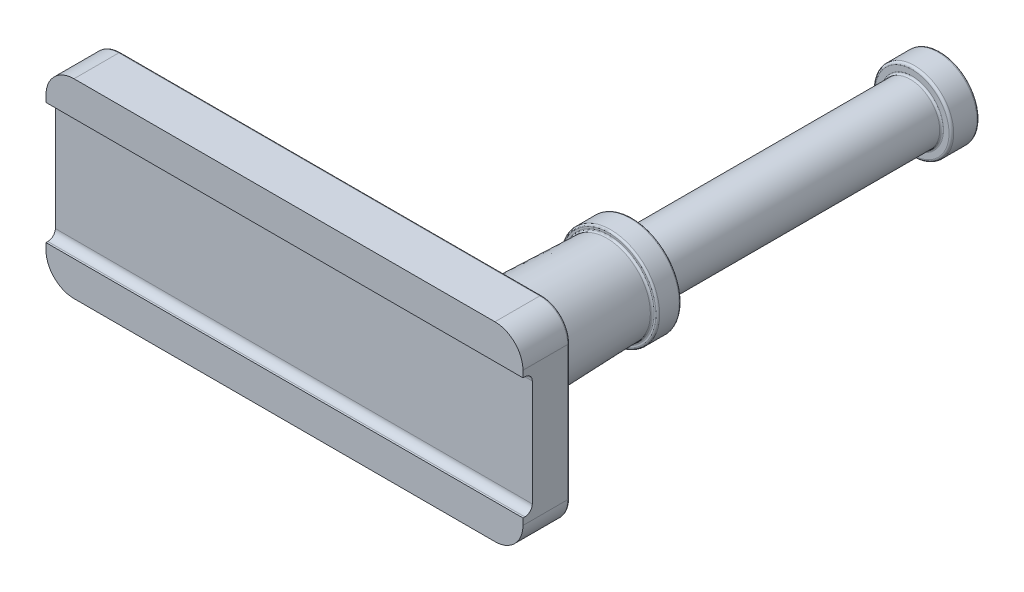
from build123d import *

# Parameters (mm, degrees)
SKETCH1_W      = 2555
SKETCH1_H      = 1020
EXTRUDE1_DEPTH = 250
FILLET1_R      = 150
FILLET2_R      = 10
EXTRUDE2_DEPTH = 150
FILLET3_R      = 20
EXTRUDE3_DEPTH = 50
FILLET4_R      = 10
EXTRUDE4_DEPTH = 3611.834391107
SCALE1_SCALE   = 0.8
FILLET5_R      = 10


with BuildPart() as part:
    # Sketch1 → Extrude1 (new body)
    with BuildSketch(Plane.XY):
        Rectangle(SKETCH1_W, SKETCH1_H)
    extrude(amount=EXTRUDE1_DEPTH)

    # Fillet1
    fillet1_edges = [part.edges().sort_by_distance(p)[0] for p in [
        (1277.5, -510, 125),
        (-1277.5, -510, 125),
        (-1277.5, 510, 125),
        (1277.5, 510, 125),
    ]]
    fillet(fillet1_edges, radius=FILLET1_R)

    # Sketch4 → Revolve1 (revolve)
    with BuildSketch(Plane(origin=(762.5, 0, 0), x_dir=(0, 0, -1), z_dir=(1, 0, 0)), mode=Mode.PRIVATE) as revolve1_sk:
        Polygon((0, 0), (2500, 0), (2500, 210), (2350, 210), (2350, 157.5), (850, 157.5), (850, 262.5), (725, 262.5), (725, 232.5), (80, 255.023896322), (80, 300), (0, 300), align=None)
    revolve(revolve1_sk.sketch.rotate(Axis((762.5, 0, -2500), (0, 0, -1)), 90), axis=Axis((762.5, 0, -2500), (0, 0, -1)))

    # Fillet2
    fillet2_edges = [part.edges().sort_by_distance(p)[0] for p in [
        (462.5, 0, 0),
        (605, 0, -2350),
        (605, 0, -850),
        (500, 0, -850),
        (500, 0, -725),
        (530, 0, -725),
        (507.476103678, 0, -80),
        (462.5, 0, -80),
    ]]
    fillet(fillet2_edges, radius=FILLET2_R)

    # Sketch5 → Extrude2 (cut)
    with BuildSketch(Plane(origin=(0, 0, 0), x_dir=(-1, 0, 0), z_dir=(0, 0, -1))):
        with BuildLine():
            Line((1127.5, 395), (1127.5, 315))
            Line((1127.5, 315), (1072.5, 260))
            Line((1072.5, 260), (-290, 260))
            Line((-290, 260), (-302.5, 272.5))
            Line((-302.5, 272.5), (-382.5, 272.5))
            Line((-382.5, 272.5), (-382.5, 222.5))
            Line((-382.5, 222.5), (-302.5, 222.5))
            Line((-302.5, 222.5), (-290, 235))
            Line((-290, 235), (1072.5, 235))
            Line((1072.5, 235), (1072.5, 95))
            Line((1072.5, 95), (-290, 95))
            Line((-290, 95), (-302.5, 107.5))
            Line((-302.5, 107.5), (-382.5, 107.5))
            Line((-382.5, 107.5), (-382.5, 57.5))
            Line((-382.5, 57.5), (-302.5, 57.5))
            Line((-302.5, 57.5), (-290, 70))
            Line((-290, 70), (1072.5, 70))
            Line((1072.5, 70), (1072.5, -70))
            Line((1072.5, -70), (-290, -70))
            Line((-290, -70), (-302.5, -57.5))
            Line((-302.5, -57.5), (-382.5, -57.5))
            Line((-382.5, -57.5), (-382.5, -107.5))
            Line((-382.5, -107.5), (-302.5, -107.5))
            Line((-302.5, -107.5), (-290, -95))
            Line((-290, -95), (1072.5, -95))
            Line((1072.5, -95), (1072.5, -235))
            Line((1072.5, -235), (-290, -235))
            Line((-290, -235), (-302.5, -222.5))
            Line((-302.5, -222.5), (-382.5, -222.5))
            Line((-382.5, -222.5), (-382.5, -272.5))
            Line((-382.5, -272.5), (-302.5, -272.5))
            Line((-302.5, -272.5), (-290, -260))
            Line((-290, -260), (1072.5, -260))
            Line((1072.5, -260), (1127.5, -315))
            Line((1127.5, -315), (1127.5, -395))
            Line((1127.5, -395), (-292.361218113, -395))
            ThreePointArc((-292.361218113, -395), (-321.606100707, -385.555355283), (-339.802682264, -360.789473684))
            ThreePointArc((-339.802682264, -360.789473684), (-418.999819754, -348.679605666), (-382.5, -420))
            Line((-382.5, -420), (1127.5, -420))
            ThreePointArc((1127.5, -420), (1169.926406871, -402.426406871), (1187.5, -360))
            Line((1187.5, -360), (1187.5, 360))
            ThreePointArc((1187.5, 360), (1169.926406871, 402.426406871), (1127.5, 420))
            Line((1127.5, 420), (-382.5, 420))
            ThreePointArc((-382.5, 420), (-418.999819754, 348.679605666), (-339.802682264, 360.789473684))
            ThreePointArc((-339.802682264, 360.789473684), (-321.606100707, 385.555355283), (-292.361218113, 395))
            Line((-292.361218113, 395), (1127.5, 395))
        make_face()
    extrude(amount=-EXTRUDE2_DEPTH, mode=Mode.SUBTRACT)

    # Fillet3
    fillet3_edges = [part.edges().sort_by_distance(p)[0] for p in [
        (-1127.5, -395, 75),
        (-1127.5, -315, 75),
        (-1072.5, -260, 75),
        (-1072.5, -235, 75),
        (-1072.5, -95, 75),
        (-1072.5, -70, 75),
        (-1072.5, 70, 75),
        (-1072.5, 95, 75),
        (-1072.5, 235, 75),
        (-1072.5, 260, 75),
        (-1127.5, 315, 75),
        (-1127.5, 395, 75),
    ]]
    fillet(fillet3_edges, radius=FILLET3_R)

    # Sketch7 → Extrude3 (cut)
    with BuildSketch(Plane(origin=(0, 0, 0), x_dir=(-1, 0, 0), z_dir=(0, 0, -1))):
        with BuildLine():
            Line((-557.5, -420), (-1127.5, -420))
            ThreePointArc((-1127.5, -420), (-1169.926406871, -402.426406871), (-1187.5, -360))
            Line((-1187.5, -360), (-1187.5, 360))
            ThreePointArc((-1187.5, 360), (-1169.926406871, 402.426406871), (-1127.5, 420))
            Line((-1127.5, 420), (-557.5, 420))
            ThreePointArc((-557.5, 420), (-529.215728753, 408.284271247), (-517.5, 380))
            Line((-517.5, 380), (-517.5, 337.638860323))
            ThreePointArc((-517.5, 337.638860323), (-537.883422149, 302.779286696), (-578.259493671, 303.447583328))
            ThreePointArc((-578.259493671, 303.447583328), (-1117.5, 0), (-578.259493671, -303.447583328))
            ThreePointArc((-578.259493671, -303.447583328), (-537.883422149, -302.779286696), (-517.5, -337.638860323))
            Line((-517.5, -337.638860323), (-517.5, -380))
            ThreePointArc((-517.5, -380), (-529.215728753, -408.284271247), (-557.5, -420))
        make_face()
    extrude(amount=-EXTRUDE3_DEPTH, mode=Mode.SUBTRACT)

    # Fillet4
    fillet4_edges = [part.edges().sort_by_distance(p)[0] for p in [
        (418.999819754, 348.679605666, 0),
        (321.606100707, 385.555355283, 0),
        (-407.569390943, 395, 0),
        (296.25, 266.25, 0),
        (342.5, 272.5, 0),
        (382.5, 247.5, 0),
        (342.5, 222.5, 0),
        (296.25, 228.75, 0),
        (-381.25, 235, 0),
        (296.25, 101.25, 0),
        (342.5, 107.5, 0),
        (382.5, 82.5, 0),
        (342.5, 57.5, 0),
        (296.25, 63.75, 0),
        (-381.25, 70, 0),
        (296.25, -63.75, 0),
        (342.5, -57.5, 0),
        (382.5, -82.5, 0),
        (342.5, -107.5, 0),
        (296.25, -101.25, 0),
        (-381.25, -95, 0),
        (296.25, -228.75, 0),
        (342.5, -222.5, 0),
        (382.5, -247.5, 0),
        (342.5, -272.5, 0),
        (296.25, -266.25, 0),
        (-387.107864376, -260, 0),
        (321.606100707, -385.555355283, 0),
        (418.999819754, -348.679605666, 0),
        (-372.5, -420, 0),
        (-1169.926406871, -402.426406871, 0),
        (-1187.5, 0, 0),
        (-1169.926406871, 402.426406871, 0),
        (-372.5, 420, 0),
        (1277.5, 0, 0),
        (0, -510, 0),
        (-1277.5, 0, 0),
        (0, 510, 0),
        (-1233.566017178, 466.066017178, 0),
        (1233.566017178, 466.066017178, 0),
        (-1233.566017178, -466.066017178, 0),
        (1233.566017178, -466.066017178, 0),
        (-1127.5, 349.142135624, 0),
        (-407.569390943, -395, 0),
        (-1127.5, -349.142135624, 0),
        (-1100, -287.5, 0),
        (-381.25, -235, 0),
        (-1072.5, -165, 0),
        (-381.25, -70, 0),
        (-1072.5, 0, 0),
        (-381.25, 95, 0),
        (-1072.5, 165, 0),
        (-387.107864376, 260, 0),
        (-1100, 287.5, 0),
        (-1125.97759065, -315.6306026, 0),
        (-1071.8693974, -261.52240935, 0),
        (-1066.642135624, -229.142135624, 0),
        (-1066.642135624, -100.857864376, 0),
        (-1066.642135624, -64.142135624, 0),
        (-1066.642135624, 64.142135624, 0),
        (-1066.642135624, 100.857864376, 0),
        (-1066.642135624, 229.142135624, 0),
        (-1071.8693974, 261.52240935, 0),
        (-1125.97759065, 315.6306026, 0),
        (-1121.642135624, -389.142135624, 0),
        (-1121.642135624, 389.142135624, 0),
        (1169.926406871, -402.426406871, 50),
        (1187.5, 0, 50),
        (1169.926406871, 402.426406871, 50),
        (842.5, 420, 50),
        (529.215728753, 408.284271247, 50),
        (517.5, 358.819430161, 50),
        (537.883422149, 302.779286696, 50),
        (1117.5, 0, 50),
        (537.883422149, -302.779286696, 50),
        (517.5, -358.819430161, 50),
        (529.215728753, -408.284271247, 50),
        (842.5, -420, 50),
        (1169.926406871, -402.426406871, 0),
        (842.5, -420, 0),
        (529.215728753, -408.284271247, 0),
        (517.5, -358.819430161, 0),
        (537.883422149, -302.779286696, 0),
        (1117.5, 0, 0),
        (537.883422149, 302.779286696, 0),
        (517.5, 358.819430161, 0),
        (529.215728753, 408.284271247, 0),
        (842.5, 420, 0),
        (1169.926406871, 402.426406871, 0),
        (1187.5, 0, 0),
    ]]
    fillet(fillet4_edges, radius=FILLET4_R)

    # Sketch8 → Extrude4 (cut, through all)
    with BuildSketch(Plane(origin=(1277.5, 0, 0), x_dir=(0, 0, -1), z_dir=(1, 0, 0))):
        with BuildLine():
            Line((-250, 325), (-240, 325))
            ThreePointArc((-240, 325), (-211.715728753, 313.284271247), (-200, 285))
            Line((-200, 285), (-200, -285))
            ThreePointArc((-200, -285), (-211.715728753, -313.284271247), (-240, -325))
            Line((-240, -325), (-250, -325))
            Line((-250, -325), (-250, 325))
        make_face()
    extrude(amount=-EXTRUDE4_DEPTH, mode=Mode.SUBTRACT)


with BuildPart() as part_1:
    # Scale1: scaled about (306.70321942, 0, -305.001599753)
    add(part.part.scale(SCALE1_SCALE).moved(Location((61.340643884, 0, -61.000319951))))

    # Fillet5
    fillet5_edges = [part_1.edges().sort_by_distance(p)[0] for p in [
        (503.340643884, 0, -2061.000319951),
        (503.340643884, 0, -1941.000319951),
    ]]
    fillet(fillet5_edges, radius=FILLET5_R)


solid = part_1.part
